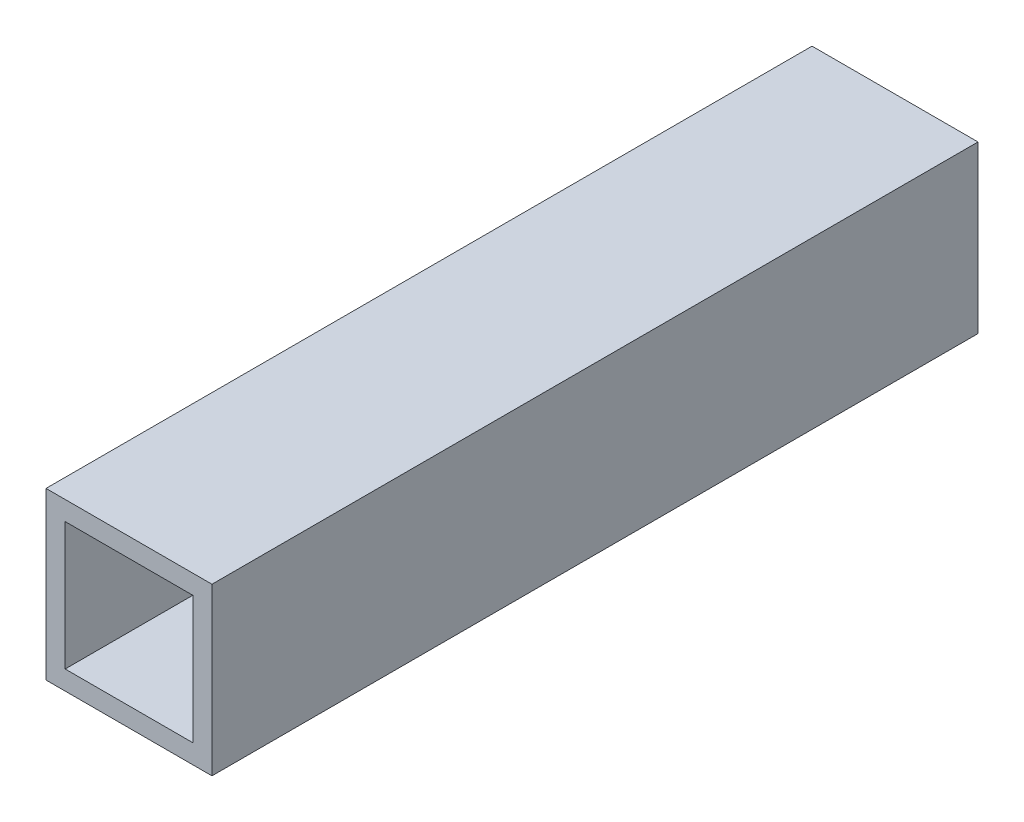
from build123d import *

# Parameters (mm, degrees)
SKETCH1_W           = 13
SKETCH1_H           = 13
SKETCH1_W_2         = 10
SKETCH1_H_2         = 10
BOSS_EXTRUDE1_DEPTH = 60


with BuildPart() as part:
    # Sketch1 → Boss-Extrude1 (new body)
    with BuildSketch(Plane.XY):
        Rectangle(SKETCH1_W, SKETCH1_H)
        Rectangle(SKETCH1_W_2, SKETCH1_H_2, mode=Mode.SUBTRACT)
    extrude(amount=BOSS_EXTRUDE1_DEPTH)


solid = part.part
